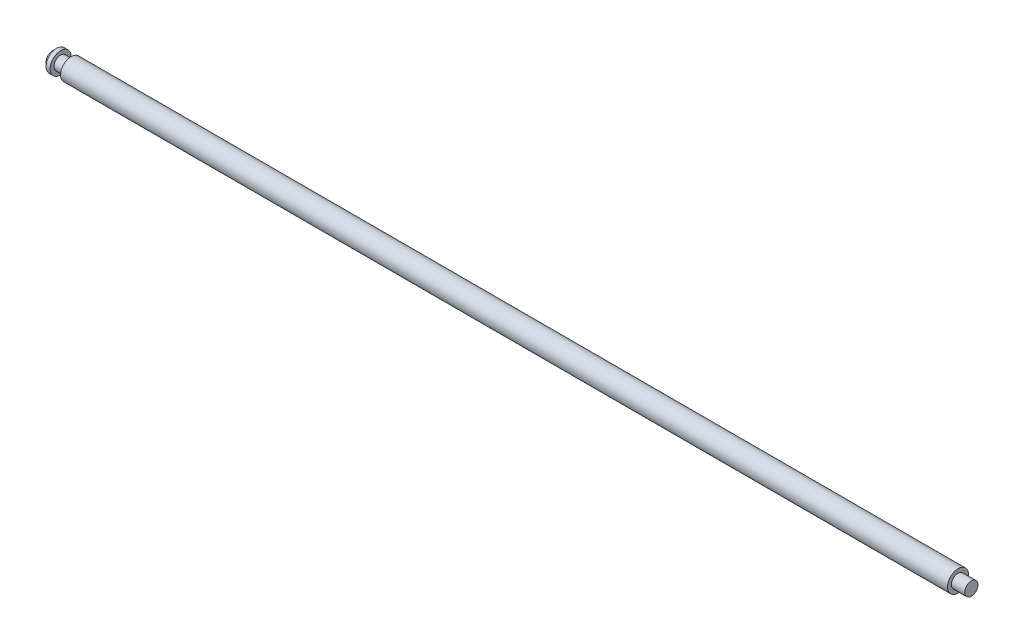
from build123d import *


with BuildPart() as part:
    # Croquis1 → Revolución1 (revolve)
    with BuildSketch(Plane(origin=(0, 0, 0), x_dir=(1, 0, 0), z_dir=(0, 1, 0)), mode=Mode.PRIVATE) as revoluci_n1_sk:
        Polygon((-195.85, 4.7625), (-195.85, 3), (-200.55, 3), (-200.55, 4.7625), (-202.4, 4.7625), (-202.4, 3), (-204.15, 3), (-204.15, 0), (210.15, 0), (210.15, 3), (204.15, 3), (204.15, 4.7625), align=None)
    revolve(revoluci_n1_sk.sketch.rotate(Axis((-204.15, 0, 0), (1, 0, 0)), 180), axis=Axis((-204.15, 0, 0), (1, 0, 0)))


solid = part.part
